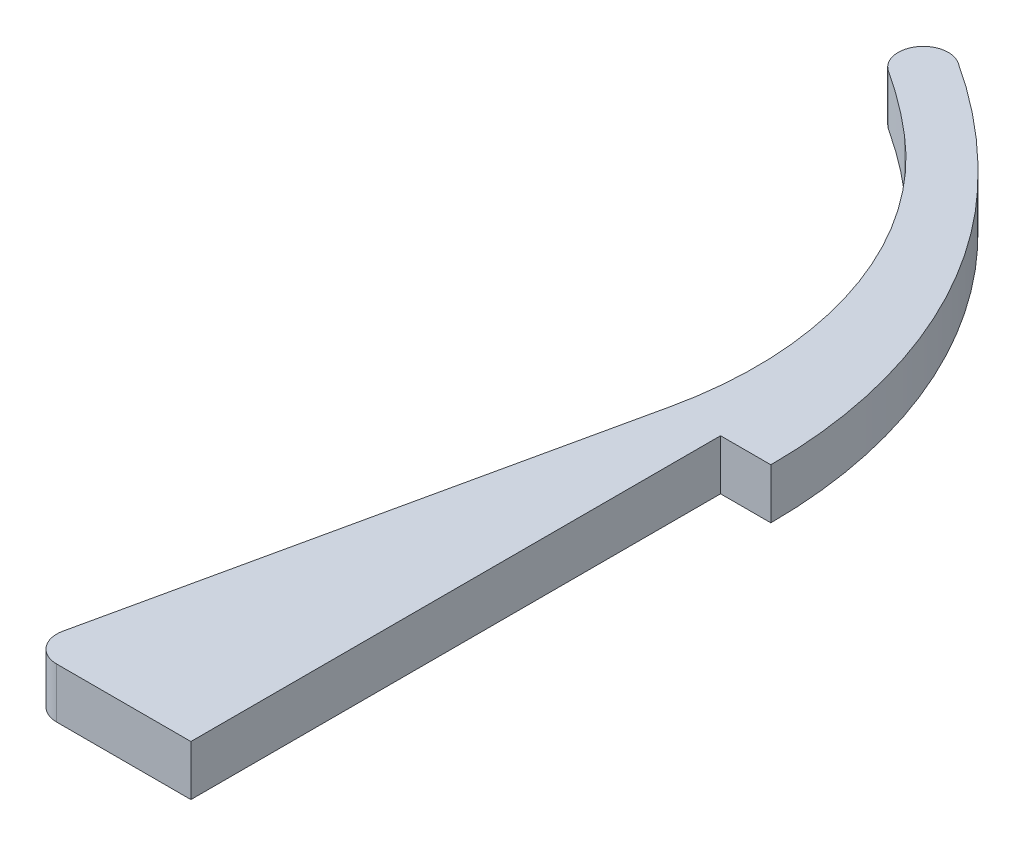
from build123d import *

# Parameters (mm, degrees)
BOSS_EXTRUDE1_DEPTH = 19.05


with BuildPart() as part:
    # Sketch1 → Boss-Extrude1 (new body)
    with BuildSketch(Plane(origin=(0, 0, 0), x_dir=(1, 0, 0), z_dir=(0, 1, 0))):
        with BuildLine():
            Line((0, 0), (-50.8, 0))
            ThreePointArc((-50.8, 0), (-58.469137427, 3.673291188), (-60.413921301, 11.951367819))
            Line((-60.413921301, 11.951367819), (-19.05, 200.52150033))
            ThreePointArc((-19.05, 200.52150033), (-22.940110947, 273.310750301), (-63.619044117, 333.79737916))
            ThreePointArc((-63.619044117, 333.79737916), (-75.370955214, 343.219242923), (-87.729421071, 351.830122835))
            ThreePointArc((-87.729421071, 351.830122835), (-90.543698917, 365.003242823), (-77.370578929, 367.817520668))
            ThreePointArc((-77.370578929, 367.817520668), (-53.490221725, 350.184763018), (-31.937222332, 329.772663182))
            ThreePointArc((-31.937222332, 329.772663182), (5.842491744, 269.993724887), (19.05, 200.52150033))
            Line((19.05, 200.52150033), (0, 200.52150033))
            Line((0, 200.52150033), (0, 0))
        make_face()
    extrude(amount=BOSS_EXTRUDE1_DEPTH)


solid = part.part
